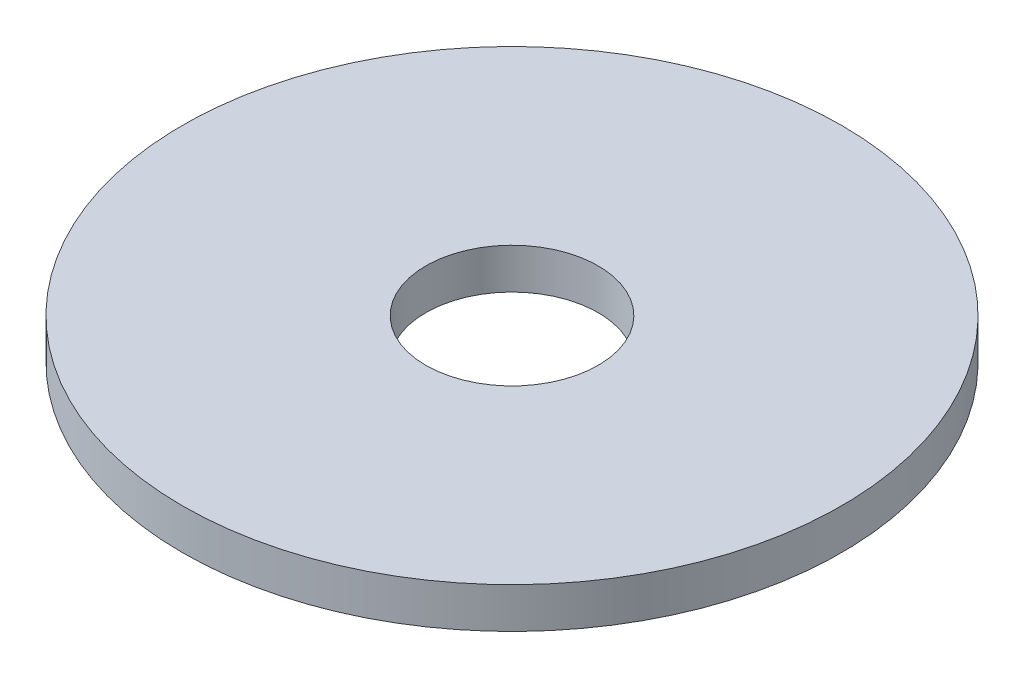
from build123d import *

# Parameters (mm, degrees)
SKETCH1_R           = 8.125
BOSS_EXTRUDE1_DEPTH = 1
SKETCH2_R           = 2.125
CUT_EXTRUDE1_DEPTH  = 1


with BuildPart() as part:
    # Sketch1 → Boss-Extrude1 (new body)
    with BuildSketch(Plane(origin=(0, 0, 0), x_dir=(1, 0, 0), z_dir=(0, 1, 0))):
        with Locations(Location((0, 0, 0), (0, 0, 270))):
            Circle(SKETCH1_R)
    extrude(amount=BOSS_EXTRUDE1_DEPTH)

    # Sketch2 → Cut-Extrude1 (cut)
    with BuildSketch(Plane(origin=(0, 1, 0), x_dir=(1, 0, 0), z_dir=(0, 1, 0))):
        with Locations(Location((0, 0, 0), (0, 0, 270))):
            Circle(SKETCH2_R)
    extrude(amount=-CUT_EXTRUDE1_DEPTH, mode=Mode.SUBTRACT)


solid = part.part
